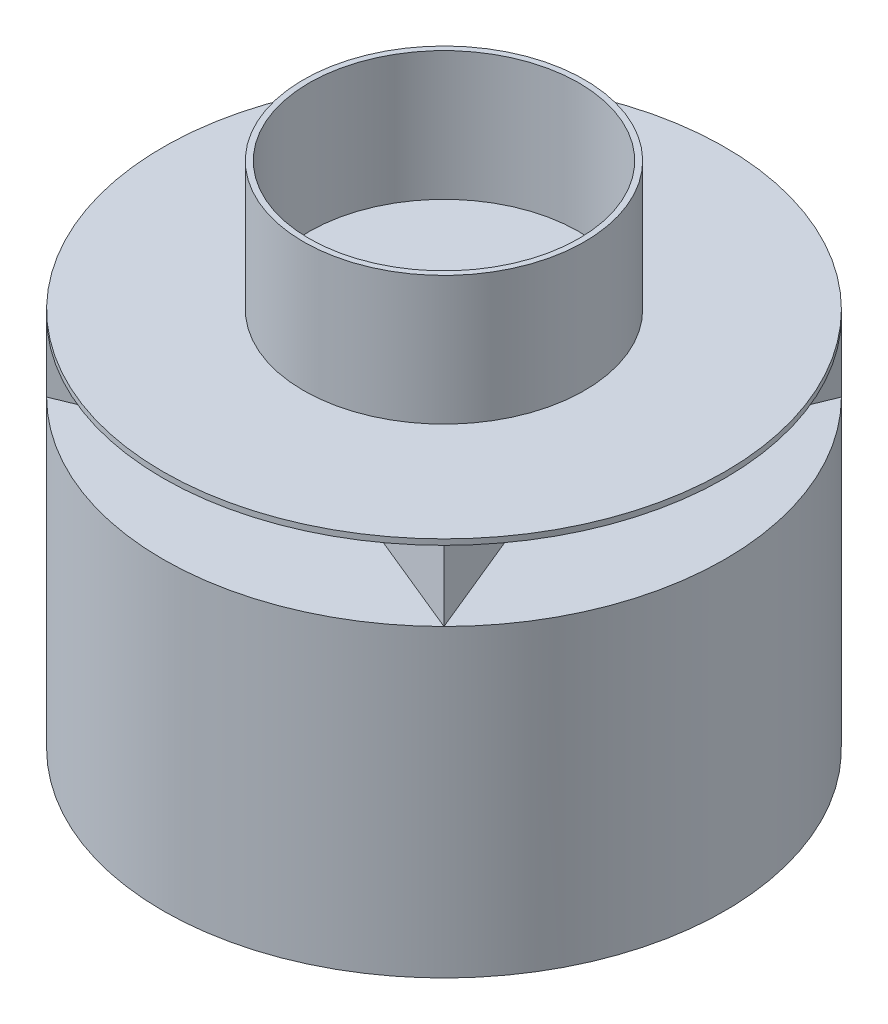
from build123d import *

# Parameters (mm, degrees)
SKETCH11_R          = 304.8
BOSS_EXTRUDE5_DEPTH = 330.2
BOSS_EXTRUDE6_DEPTH = 76.2
SKETCH13_R          = 304.8
BOSS_EXTRUDE7_DEPTH = 6.096
SKETCH14_R          = 152.4
SKETCH14_R_2        = 146.304
BOSS_EXTRUDE8_DEPTH = 139.7


with BuildPart() as part:
    # Sketch11 → Boss-Extrude5 (new body)
    with BuildSketch(Plane(origin=(0, 0, 0), x_dir=(1, 0, 0), z_dir=(0, 1, 0))):
        with Locations(Location((0, 0, 0), (0, 0, 270))):
            Circle(SKETCH11_R)
    extrude(amount=BOSS_EXTRUDE5_DEPTH)

    # Sketch12 → Boss-Extrude6 (add)
    with BuildSketch(Plane(origin=(0, 330.2, 0), x_dir=(1, 0, 0), z_dir=(0, 1, 0))):
        Polygon((-127, 0), (-215.526146906, -215.526146906), (0, -127), (215.526146906, -215.526146906), (127, 0), (215.526146906, 215.526146906), (0, 127), (-215.526146906, 215.526146906), align=None)
    extrude(amount=BOSS_EXTRUDE6_DEPTH)

    # Sketch13 → Boss-Extrude7 (add)
    with BuildSketch(Plane(origin=(0, 406.4, 0), x_dir=(1, 0, 0), z_dir=(0, 1, 0))):
        with Locations(Location((0, 0, 0), (0, 0, 135))):
            Circle(SKETCH13_R)
    extrude(amount=BOSS_EXTRUDE7_DEPTH)

    # Sketch14 → Boss-Extrude8 (add)
    with BuildSketch(Plane(origin=(0, 412.496, 0), x_dir=(1, 0, 0), z_dir=(0, 1, 0))):
        with Locations(Location((0, 0, 0), (0, 0, 270))):
            Circle(SKETCH14_R)
        with Locations(Location((0, 0, 0), (0, 0, 270))):
            Circle(SKETCH14_R_2, mode=Mode.SUBTRACT)
    extrude(amount=BOSS_EXTRUDE8_DEPTH)


solid = part.part
